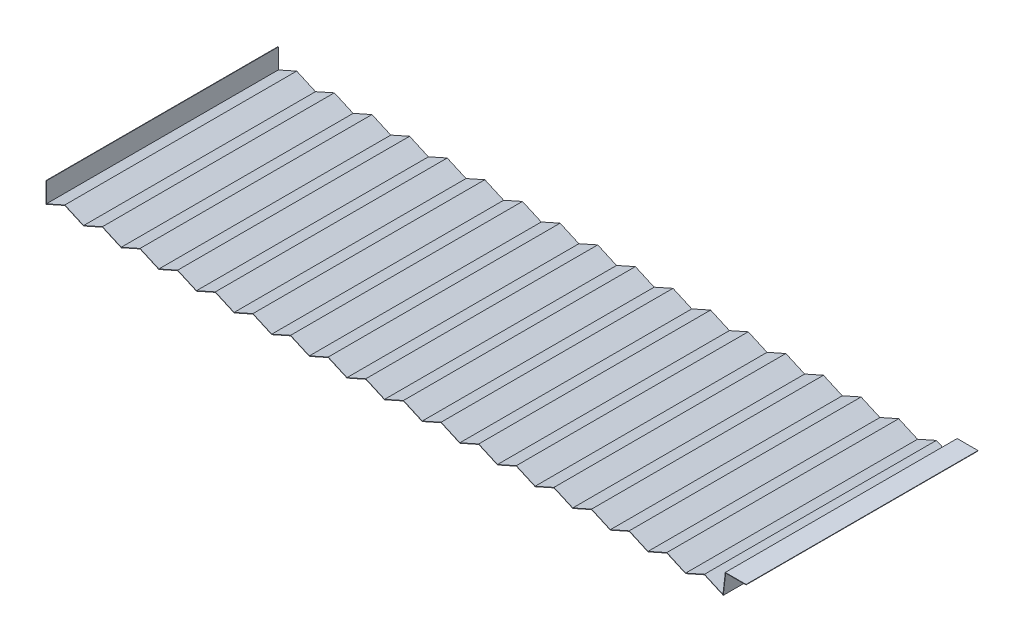
from build123d import *

# Parameters (mm, degrees)
EXTRUDE_THIN1_DEPTH = 85


with BuildPart() as part:
    # Sketch1 → Extrude-Thin1 (new, symmetric)
    with BuildSketch(Plane.XY):
        Polygon((0, 15.1), (0, 0), (13.79208513, 6.147226022), (27.58417026, 0), (41.37625539, 6.147226022), (55.16834052, 0), (68.960425651, 6.147226022), (82.752510781, 0), (96.544595911, 6.147226022), (110.336681041, 0), (124.128766171, 6.147226022), (137.920851301, 0), (151.712936431, 6.147226022), (165.505021561, 0), (179.297106692, 6.147226022), (193.089191822, 0), (206.881276952, 6.147226022), (220.673362082, 0), (234.465447212, 6.147226022), (248.257532342, 0), (262.049617472, 6.147226022), (275.841702602, 0), (289.633787732, 6.147226022), (303.425872863, 0), (317.217957993, 6.147226022), (331.010043123, 0), (344.802128253, 6.147226022), (358.594213383, 0), (372.386298513, 6.147226022), (386.178383643, 0), (399.970468773, 6.147226022), (413.762553904, 0), (427.554639034, 6.147226022), (441.346724164, 0), (455.138809294, 6.147226022), (468.930894424, 0), (482.722979554, 6.147226022), (496.515064684, 0), (498.249999842, 15), (513.249999842, 15), (513.249999842, 15.3), (497.982698545, 15.3), (496.263996817, 0.440351902), (482.722979554, 6.475675271), (468.930894424, 0.328449249), (455.138809294, 6.475675271), (441.346724164, 0.328449249), (427.554639034, 6.475675271), (413.762553904, 0.328449249), (399.970468773, 6.475675271), (386.178383643, 0.328449249), (372.386298513, 6.475675271), (358.594213383, 0.328449249), (344.802128253, 6.475675271), (331.010043123, 0.328449249), (317.217957993, 6.475675271), (303.425872863, 0.328449249), (289.633787732, 6.475675271), (275.841702602, 0.328449249), (262.049617472, 6.475675271), (248.257532342, 0.328449249), (234.465447212, 6.475675271), (220.673362082, 0.328449249), (206.881276952, 6.475675271), (193.089191822, 0.328449249), (179.297106692, 6.475675271), (165.505021561, 0.328449249), (151.712936431, 6.475675271), (137.920851301, 0.328449249), (124.128766171, 6.475675271), (110.336681041, 0.328449249), (96.544595911, 6.475675271), (82.752510781, 0.328449249), (68.960425651, 6.475675271), (55.16834052, 0.328449249), (41.37625539, 6.475675271), (27.58417026, 0.328449249), (13.79208513, 6.475675271), (0.3, 0.462161286), (0.3, 15.1), align=None)
    extrude(amount=EXTRUDE_THIN1_DEPTH, both=True)


solid = part.part
